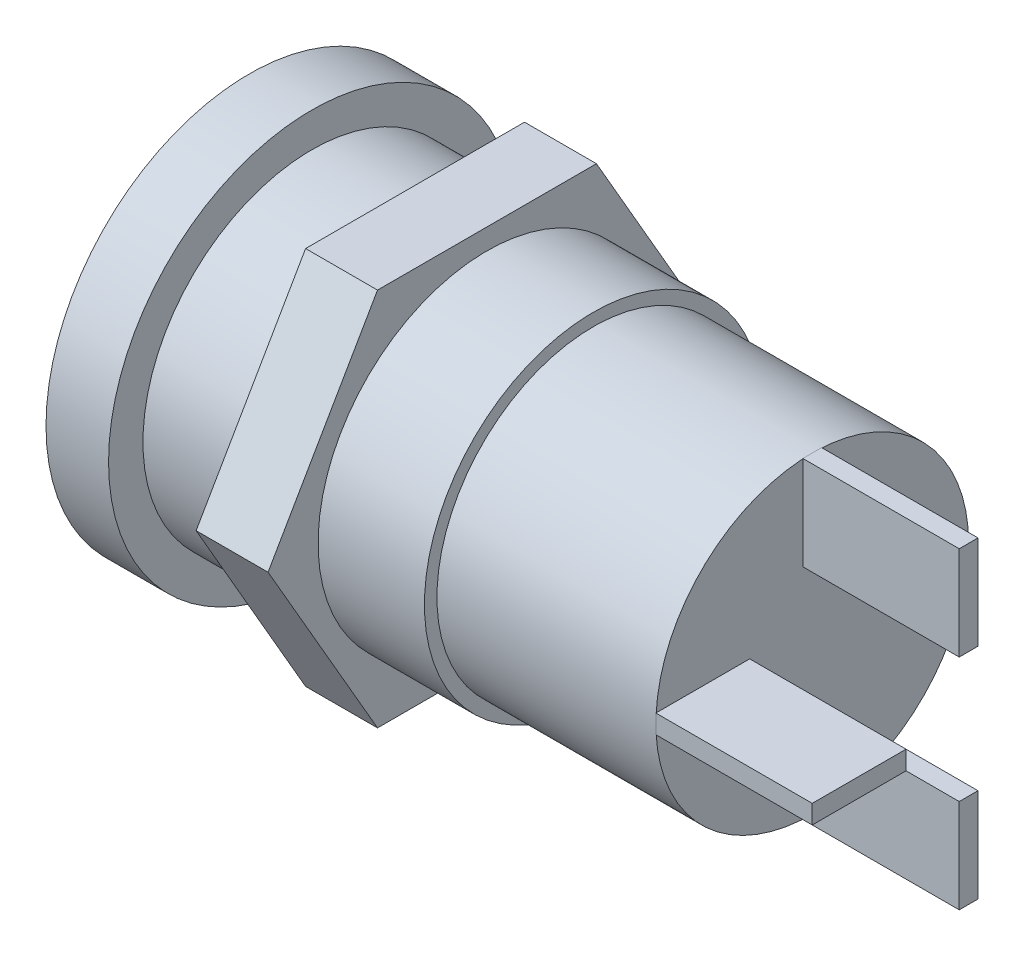
from build123d import *

# Parameters (mm, degrees)
FRONT_START          = -2
SK_FRONT_COLLAR_R    = 6.5
SK_FRONT_COLLAR_R_2  = 2.9
FRONT_COLLAR_DEPTH   = 2
CENTRE_START         = -1.6
SK_CENTRE_PIN_R      = 1.05
CENTRE_PIN_DEPTH     = 10.6
SK_THREADED_BODY_R   = 5.4
SK_THREADED_BODY_R_2 = 2.9
THREADED_BODY_DEPTH  = 9
PANEL_START          = 3.3
SK_PANEL_NUT_R       = 5.4
PANEL_NUT_DEPTH      = 2.3
REAR_START           = 9
SK_REAR_HOUSING_R    = 5
REAR_HOUSING_DEPTH   = 7
SOLDER_START         = 16
SK_SOLDER_TABS_W     = 0.6
SK_SOLDER_TABS_H     = 3
SOLDER_TABS_DEPTH    = 5
SOLDER_TABS_2_DEPTH  = 5
SK_SOLDER_TABS_W_2   = 3
SK_SOLDER_TABS_H_2   = 0.6
SOLDER_TABS_3_DEPTH  = 5


with BuildPart() as part:
    # SK Front collar → Front collar (new body)
    with BuildSketch(Plane(origin=(0, 0, 0), x_dir=(0, 0, -1), z_dir=(1, 0, 0)).offset(FRONT_START)):
        Circle(SK_FRONT_COLLAR_R)
        Circle(SK_FRONT_COLLAR_R_2, mode=Mode.SUBTRACT)
    extrude(amount=FRONT_COLLAR_DEPTH)


with BuildPart() as body_2:
    # SK Centre pin → Centre pin (new body)
    with BuildSketch(Plane(origin=(0, 0, 0), x_dir=(0, 0, -1), z_dir=(1, 0, 0)).offset(CENTRE_START)):
        Circle(SK_CENTRE_PIN_R)
    extrude(amount=CENTRE_PIN_DEPTH)


with BuildPart() as body_3:
    # SK Threaded body → Threaded body (new body)
    with BuildSketch(Plane(origin=(0, 0, 0), x_dir=(0, 0, -1), z_dir=(1, 0, 0))):
        Circle(SK_THREADED_BODY_R)
        Circle(SK_THREADED_BODY_R_2, mode=Mode.SUBTRACT)
    extrude(amount=THREADED_BODY_DEPTH)


with BuildPart() as body_4:
    # SK Panel nut → Panel nut (new body)
    with BuildSketch(Plane(origin=(0, 0, 0), x_dir=(0, 0, -1), z_dir=(1, 0, 0)).offset(PANEL_START)):
        Polygon((7, 0), (3.5, 6.062177826), (-3.5, 6.062177826), (-7, 0), (-3.5, -6.062177826), (3.5, -6.062177826), align=None)
        Circle(SK_PANEL_NUT_R, mode=Mode.SUBTRACT)
    extrude(amount=PANEL_NUT_DEPTH)


with BuildPart() as body_5:
    # SK Rear housing → Rear housing (new body)
    with BuildSketch(Plane(origin=(0, 0, 0), x_dir=(0, 0, -1), z_dir=(1, 0, 0)).offset(REAR_START)):
        Circle(SK_REAR_HOUSING_R)
    extrude(amount=REAR_HOUSING_DEPTH)


with BuildPart() as body_6:
    # SK Solder tabs → Solder tabs (new body)
    with BuildSketch(Plane(origin=(0, 0, 0), x_dir=(0, 0, -1), z_dir=(1, 0, 0)).offset(SOLDER_START)):
        with Locations((0, 3.5)):
            Rectangle(SK_SOLDER_TABS_W, SK_SOLDER_TABS_H)
    extrude(amount=SOLDER_TABS_DEPTH)


with BuildPart() as body_7:
    # SK Solder tabs → Solder tabs 2 (new body)
    with BuildSketch(Plane(origin=(0, 0, 0), x_dir=(0, 0, -1), z_dir=(1, 0, 0)).offset(SOLDER_START)):
        with Locations((0, -3.5)):
            Rectangle(SK_SOLDER_TABS_W, SK_SOLDER_TABS_H)
    extrude(amount=SOLDER_TABS_2_DEPTH)


with BuildPart() as body_8:
    # SK Solder tabs → Solder tabs 3 (new body)
    with BuildSketch(Plane(origin=(0, 0, 0), x_dir=(0, 0, -1), z_dir=(1, 0, 0)).offset(SOLDER_START)):
        with Locations((-3.5, 0)):
            Rectangle(SK_SOLDER_TABS_W_2, SK_SOLDER_TABS_H_2)
    extrude(amount=SOLDER_TABS_3_DEPTH)


solid = Compound([part.part, body_2.part, body_3.part, body_4.part, body_5.part, body_6.part, body_7.part, body_8.part])
